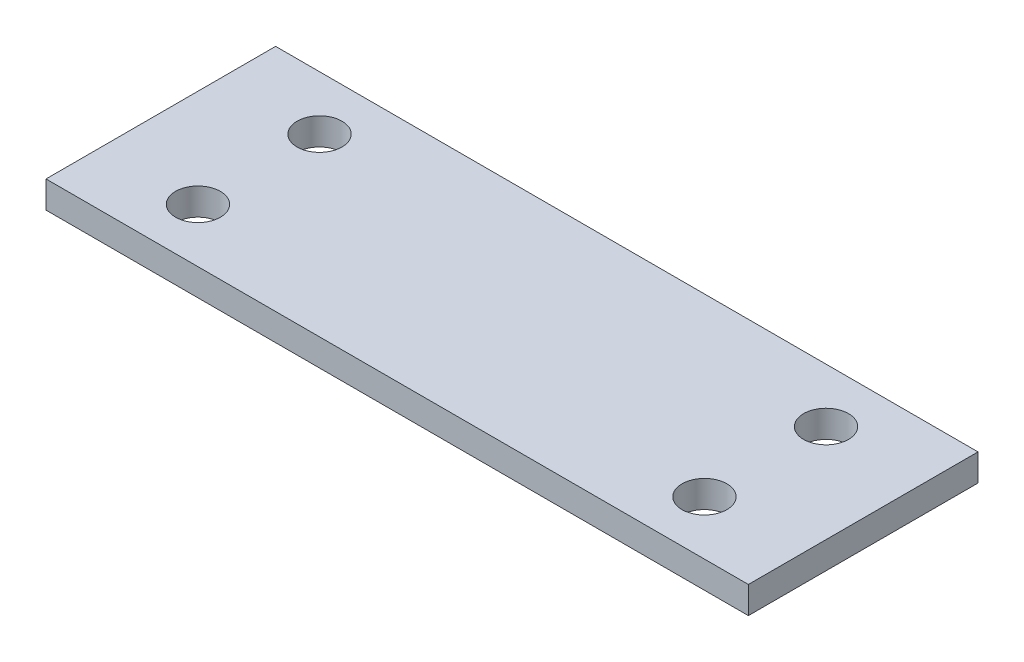
from build123d import *

# Parameters (mm, degrees)
SKETCH1_W                      = 132.08
SKETCH1_H                      = 43.18
BOSS_EXTRUDE1_DEPTH            = 5.08
F_13_64_0_332_DIAMETER_HOLE1_D = 8.4328


with BuildPart() as part:
    # Sketch1 → Boss-Extrude1 (new body)
    with BuildSketch(Plane(origin=(0, 0, 0), x_dir=(1, 0, 0), z_dir=(0, 1, 0))):
        with Locations((4.375969491, 8.263150525)):
            Rectangle(SKETCH1_W, SKETCH1_H)
    extrude(amount=BOSS_EXTRUDE1_DEPTH)

    # 13/64 (0.332) Diameter Hole1 (through all)
    with Locations(Plane(origin=(0, 5.08, 0), x_dir=(1, 0, 0), z_dir=(0, 1, 0))):
        with Locations((-43.249030509, 19.693150525), (-43.249030509, -3.166849475), (52.000969491, 19.693150525), (52.000969491, -3.166849475)):
            Hole(F_13_64_0_332_DIAMETER_HOLE1_D / 2)


solid = part.part
